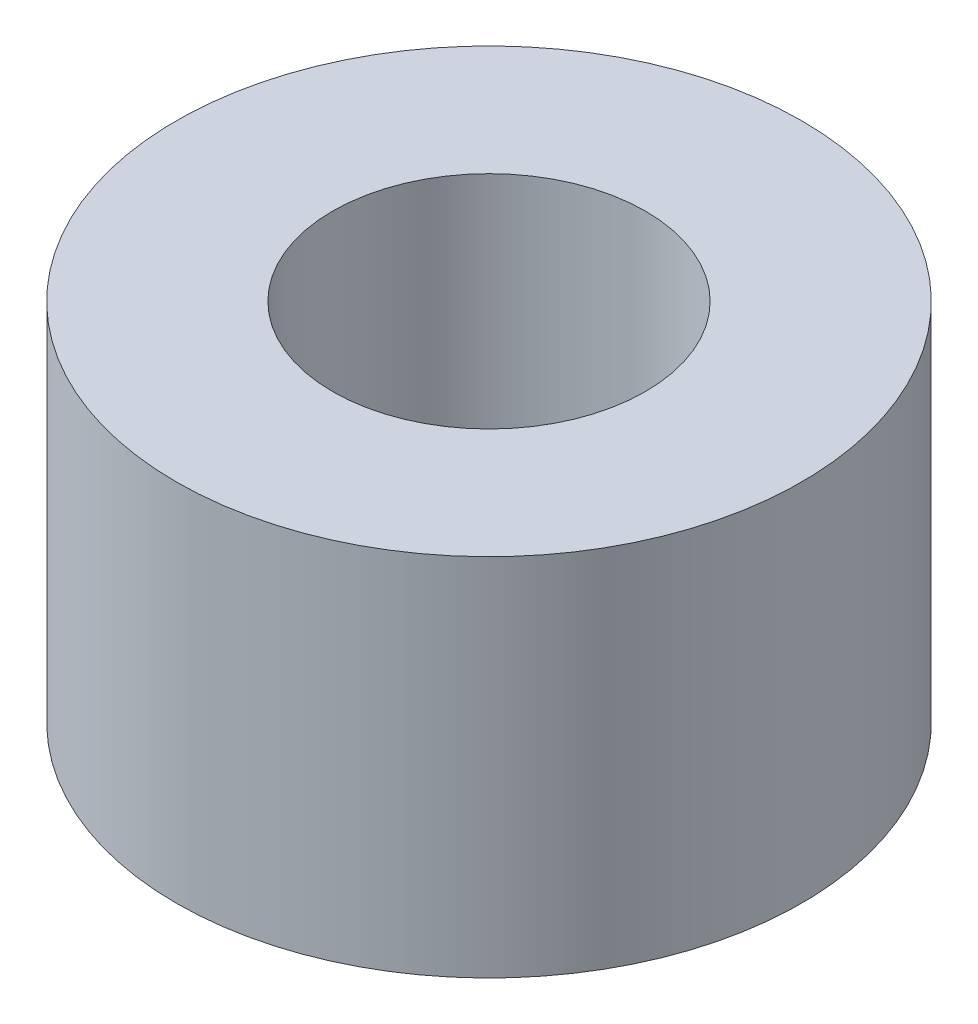
from build123d import *

# Parameters (mm, degrees)
SKETCH_1_R      = 3
SKETCH_1_R_2    = 1.5
EXTRUDE_1_DEPTH = 3.5


with BuildPart() as part:
    # 草图1 → 凸台-拉伸1 (new body)
    with BuildSketch(Plane(origin=(0, 0, 0), x_dir=(1, 0, 0), z_dir=(0, 1, 0))):
        with Locations(Location((0, 0, 0), (0, 0, 270))):
            Circle(SKETCH_1_R)
        with Locations(Location((0, 0, 0), (0, 0, 270))):
            Circle(SKETCH_1_R_2, mode=Mode.SUBTRACT)
    extrude(amount=EXTRUDE_1_DEPTH)


solid = part.part
